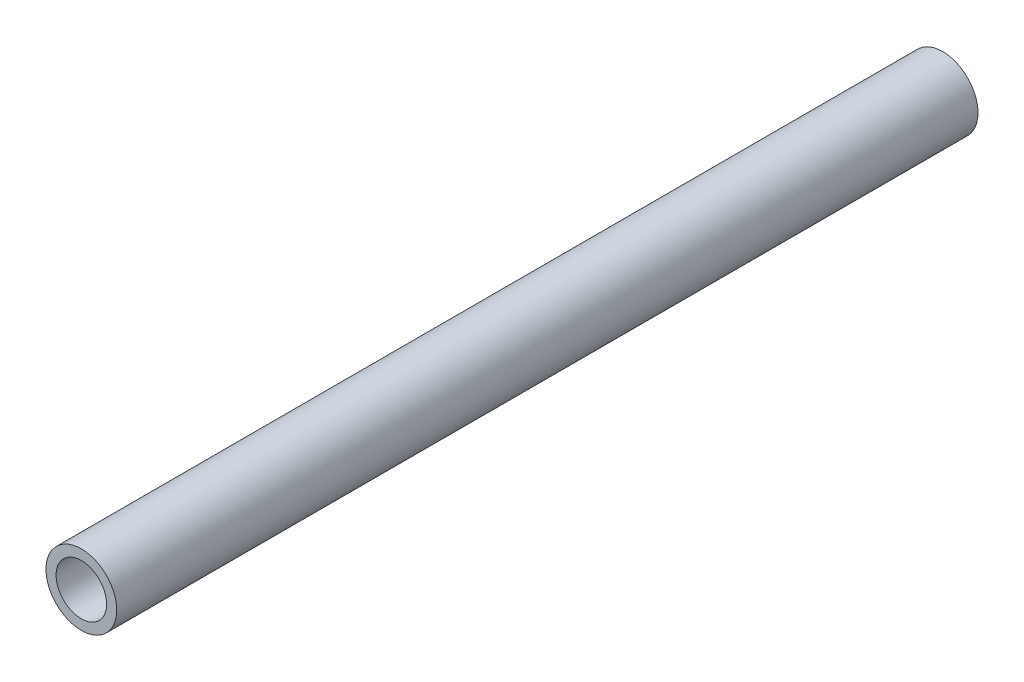
from build123d import *

# Parameters (mm, degrees)
SKETCH1_W = 1705
SKETCH1_H = 20


with BuildPart() as part:
    # Sketch1 → Revolve1 (revolve)
    with BuildSketch(Plane(origin=(0, 0, 0), x_dir=(0, 0, -1), z_dir=(1, 0, 0))):
        with Locations((-852.5, 60)):
            Rectangle(SKETCH1_W, SKETCH1_H)
    revolve(axis=Axis((0, 0, -30.052173913), (0, 0, 1)))


solid = part.part
